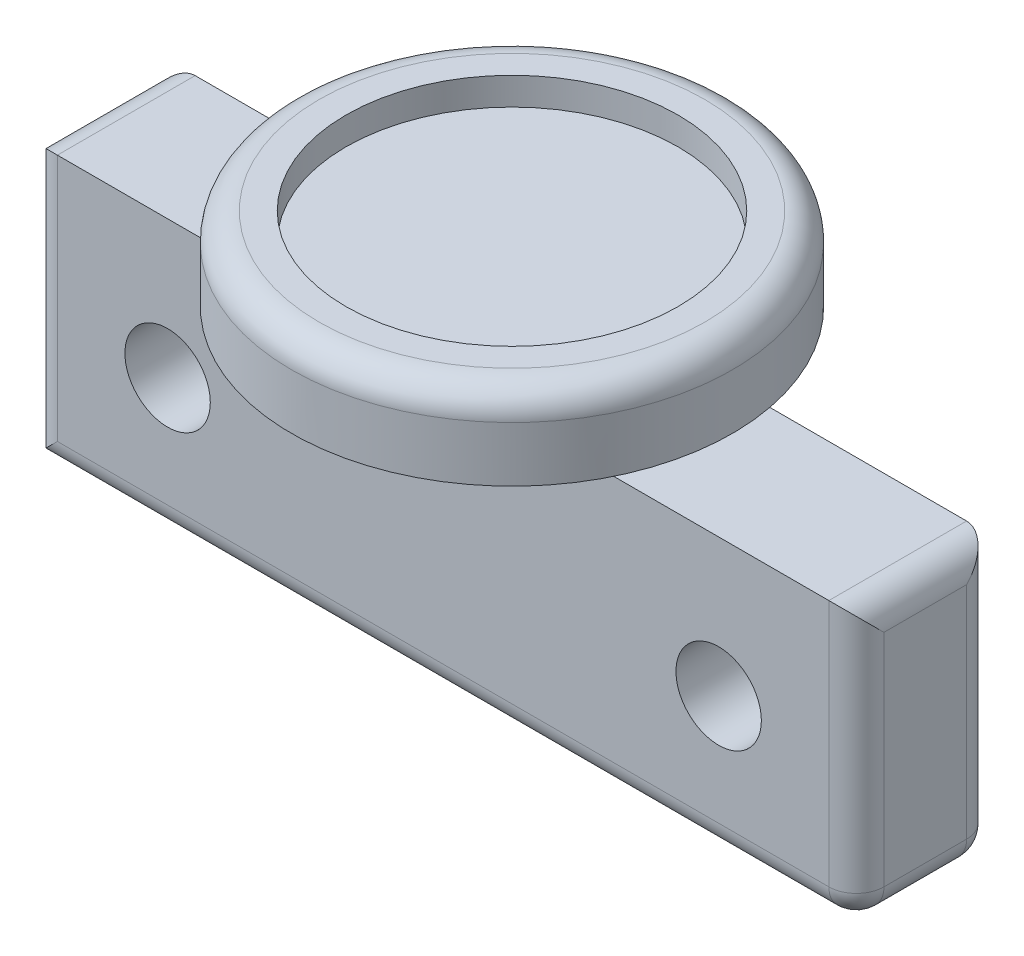
from build123d import *

# Parameters (mm, degrees)
SKETCH1_W                      = 76.2
SKETCH1_H                      = 25.4
BOSS_EXTRUDE1_DEPTH            = 6.35
SKETCH5_R                      = 12.7
BOSS_EXTRUDE3_DEPTH            = 2.54
SKETCH7_R                      = 20.32
BOSS_EXTRUDE4_DEPTH            = 7.62
SKETCH8_R                      = 15.305053728
CUT_EXTRUDE1_DEPTH             = 2.54
FILLET3_R                      = 2.54
FILLET4_R                      = 2.54
F_97_0_31_DIAMETER_HOLE1_D     = 7.874
F_97_0_31_DIAMETER_HOLE1_DEPTH = 25.4
F_97_0_31_DIAMETER_HOLE1_TIP   = 2.365588257


with BuildPart() as part:
    # Sketch1 → Boss-Extrude1 (new, symmetric)
    with BuildSketch(Plane.XY):
        Rectangle(SKETCH1_W, SKETCH1_H)
    extrude(amount=BOSS_EXTRUDE1_DEPTH, both=True)

    # Sketch5 → Boss-Extrude3 (add)
    with BuildSketch(Plane(origin=(0, 12.7, 0), x_dir=(1, 0, 0), z_dir=(0, 1, 0))):
        with Locations(Location((0, 0, 0), (0, 0, 30))):
            Circle(SKETCH5_R)
    extrude(amount=BOSS_EXTRUDE3_DEPTH)

    # Sketch7 → Boss-Extrude4 (add)
    with BuildSketch(Plane(origin=(0, 15.24, 0), x_dir=(1, 0, 0), z_dir=(0, 1, 0))):
        with Locations(Location((0, 0, 0), (0, 0, 90))):
            Circle(SKETCH7_R)
    extrude(amount=BOSS_EXTRUDE4_DEPTH)

    # Sketch8 → Cut-Extrude1 (cut)
    with BuildSketch(Plane(origin=(0, 22.86, 0), x_dir=(1, 0, 0), z_dir=(0, 1, 0))):
        with Locations(Location((0, 0, 0), (0, 0, 270))):
            Circle(SKETCH8_R)
    extrude(amount=-CUT_EXTRUDE1_DEPTH, mode=Mode.SUBTRACT)

    # Fillet3
    fillet3_edges = [part.edges().sort_by_distance(p)[0] for p in [
        (0, 22.86, 20.32),
    ]]
    fillet(fillet3_edges, radius=FILLET3_R)

    # Fillet4
    fillet4_edges = [part.edges().sort_by_distance(p)[0] for p in [
        (-38.1, 0, 6.35),
        (0, -12.7, 6.35),
        (38.1, 0, 6.35),
        (0, -12.7, -6.35),
        (-38.1, 0, -6.35),
        (38.1, 0, -6.35),
        (38.1, -12.7, 0),
        (-38.1, 12.7, 0),
        (38.1, 12.7, 0),
    ]]
    fillet(fillet4_edges, radius=FILLET4_R)

    # #97 (0.31) Diameter Hole1
    with Locations(Plane.XY.offset(6.35)):
        with Locations((25.4, 0), (-25.4, 0)):
            Hole(F_97_0_31_DIAMETER_HOLE1_D / 2, depth=F_97_0_31_DIAMETER_HOLE1_DEPTH)
            with Locations((0, 0, -(F_97_0_31_DIAMETER_HOLE1_DEPTH + F_97_0_31_DIAMETER_HOLE1_TIP / 2))):  # 118° drill point
                Cone(0, F_97_0_31_DIAMETER_HOLE1_D / 2, F_97_0_31_DIAMETER_HOLE1_TIP, mode=Mode.SUBTRACT)


solid = part.part
